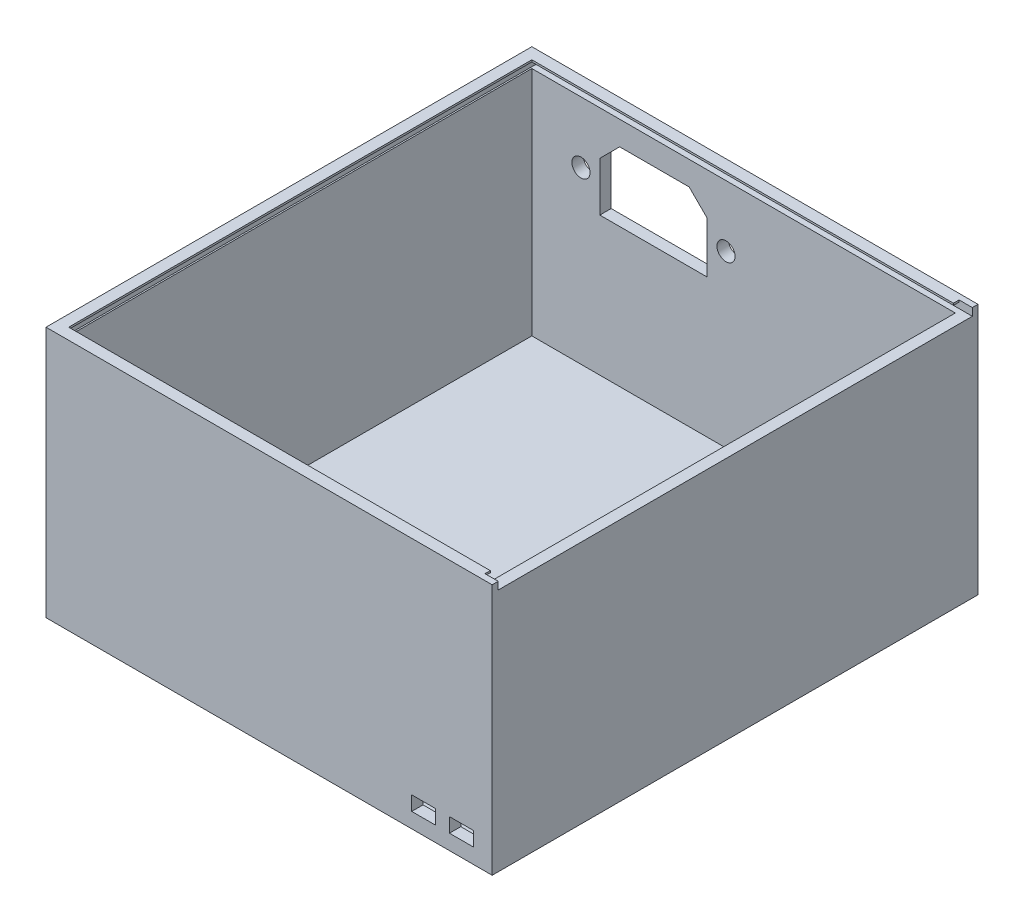
from build123d import *

# Parameters (mm, degrees)
SKETCH1_W           = 118.1
SKETCH1_H           = 128.6
BOSS_EXTRUDE2_DEPTH = 66.6
SKETCH5_R           = 2.4
CUT_EXTRUDE2_DEPTH  = 4
SKETCH4_W           = 6.3
SKETCH4_H           = 3.8
CUT_EXTRUDE3_DEPTH  = 4
SKETCH6_W           = 112.1
SKETCH6_H           = 122.6
CUT_EXTRUDE4_DEPTH  = 63.3
SKETCH9_W           = 125.5
SKETCH9_H           = 1.5
CUT_EXTRUDE7_DEPTH  = 115.5
SKETCH10_W          = 125.5
SKETCH10_H          = 1
CUT_EXTRUDE8_DEPTH  = 3.5


with BuildPart() as part:
    # Sketch1 → Boss-Extrude2 (new body)
    with BuildSketch(Plane(origin=(0, 0, 0), x_dir=(1, 0, 0), z_dir=(0, 1, 0))):
        Rectangle(SKETCH1_W, SKETCH1_H)
    extrude(amount=BOSS_EXTRUDE2_DEPTH)

    # Sketch5 → Cut-Extrude2 (cut)
    with BuildSketch(Plane(origin=(0, 0, -64.3), x_dir=(-1, 0, 0), z_dir=(0, 0, -1))):
        with Locations((43.05, 48.4)):
            Circle(SKETCH5_R)
        with Locations((4.65, 48.4)):
            Circle(SKETCH5_R)
        Polygon((9.65, 40), (38.05, 40), (38.05, 53.016960095), (32.8, 58.266960095), (14.4, 58.266960095), (9.65, 53.516960095), align=None)
    extrude(amount=-CUT_EXTRUDE2_DEPTH, mode=Mode.SUBTRACT)

    # Sketch4 → Cut-Extrude3 (cut)
    with BuildSketch(Plane.XY.offset(64.3)):
        with Locations((50.9, 5.9)):
            Rectangle(SKETCH4_W, SKETCH4_H)
        with Locations((40.9, 5.9)):
            Rectangle(SKETCH4_W, SKETCH4_H)
    extrude(amount=-CUT_EXTRUDE3_DEPTH, mode=Mode.SUBTRACT)

    # Sketch6 → Cut-Extrude4 (cut)
    with BuildSketch(Plane(origin=(0, 66.6, 0), x_dir=(1, 0, 0), z_dir=(0, 1, 0))):
        Rectangle(SKETCH6_W, SKETCH6_H)
    extrude(amount=-CUT_EXTRUDE4_DEPTH, mode=Mode.SUBTRACT)

    # Sketch9 → Cut-Extrude7 (cut)
    with BuildSketch(Plane(origin=(59.05, 0, 0), x_dir=(0, 0, -1), z_dir=(1, 0, 0))):
        with Locations((0.05, 65.35)):
            Rectangle(SKETCH9_W, SKETCH9_H)
    extrude(amount=-CUT_EXTRUDE7_DEPTH, mode=Mode.SUBTRACT)

    # Sketch10 → Cut-Extrude8 (cut)
    with BuildSketch(Plane(origin=(59.05, 0, 0), x_dir=(0, 0, -1), z_dir=(1, 0, 0))):
        with Locations((0.05, 66.1)):
            Rectangle(SKETCH10_W, SKETCH10_H)
    extrude(amount=-CUT_EXTRUDE8_DEPTH, mode=Mode.SUBTRACT)


solid = part.part
